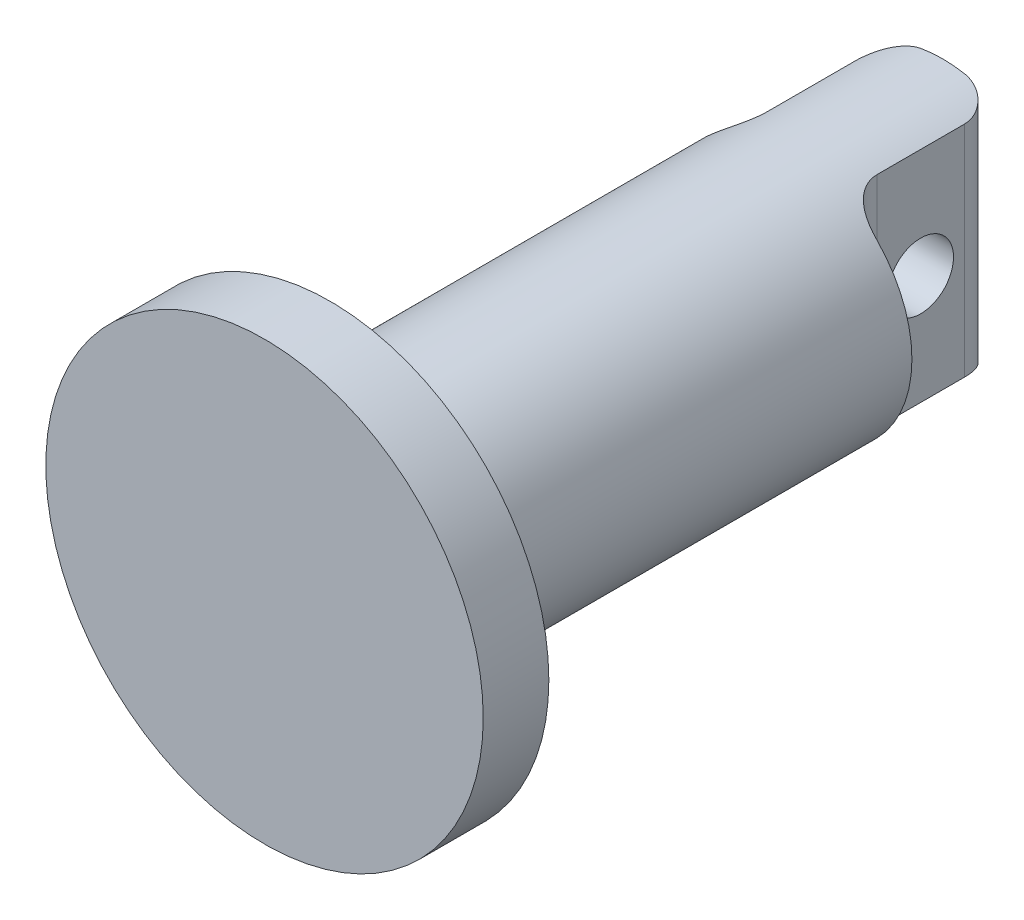
from build123d import *
from OCP.BRepFilletAPI import BRepFilletAPI_MakeFillet

# Parameters (mm, degrees)
SKETCH1_R           = 10
BOSS_EXTRUDE1_DEPTH = 3
SKETCH2_R           = 5.6
BOSS_EXTRUDE2_DEPTH = 28
CUT_EXTRUDE1_DEPTH  = 7
CUT_EXTRUDE2_REACH  = 34.253
SKETCH4_R           = 1.5
FILLET1_R1          = 3
FILLET1_R2          = 1.5


with BuildPart() as part:
    # Sketch1 → Boss-Extrude1 (new body)
    with BuildSketch(Plane.XY):
        Circle(SKETCH1_R)
    extrude(amount=BOSS_EXTRUDE1_DEPTH)

    # Sketch2 → Boss-Extrude2 (add)
    with BuildSketch(Plane(origin=(0, 0, 0), x_dir=(-1, 0, 0), z_dir=(0, 0, -1))):
        with Locations(Location((0, 0, 0), (0, 0, 180))):
            Circle(SKETCH2_R)
    extrude(amount=BOSS_EXTRUDE2_DEPTH)

    # Sketch3 → Cut-Extrude1 (cut)
    with BuildSketch(Plane(origin=(0, 0, -28), x_dir=(-1, 0, 0), z_dir=(0, 0, -1))):
        with BuildLine():
            Line((2.5, 0), (2.5, 6.663171691))
            ThreePointArc((2.5, 6.663171691), (8.066213365, -0.537352556), (2.5, -7.737876802))
            Line((2.5, -7.737876802), (2.5, 0))
        make_face()
        with BuildLine():
            Line((-2.5, 0), (-2.5, 6.663171691))
            ThreePointArc((-2.5, 6.663171691), (-7.668145551, -0.537352556), (-2.5, -7.737876802))
            Line((-2.5, -7.737876802), (-2.5, 0))
        make_face()
    extrude(amount=-CUT_EXTRUDE1_DEPTH, mode=Mode.SUBTRACT)

    # Sketch4 → Cut-Extrude2 (cut, up to next)
    with BuildSketch(Plane(origin=(2.5, 0, 0), x_dir=(0, 0, -1), z_dir=(1, 0, 0)), mode=Mode.PRIVATE) as cut_extrude2_sk1:
        with Locations((24.5, 0)):
            Circle(SKETCH4_R)
    cut_extrude2_tool1 = extrude(cut_extrude2_sk1.sketch, amount=-CUT_EXTRUDE2_REACH, mode=Mode.PRIVATE) & part.part
    add(cut_extrude2_tool1.solids().sort_by_distance((2.5, 0, -24.5))[0], mode=Mode.SUBTRACT)

    # Fillet1: one fillet with a radius per group of edges: ONE call of the kernel's fillet builder (fillet() takes one radius for all edges)
    fillet1_edges_1 = [part.edges().sort_by_distance(p)[0] for p in [
        (-5.6, 0, 0),
    ]]
    fillet1_edges_2 = [part.edges().sort_by_distance(p)[0] for p in [
        (2.5, 0, -21),
        (-2.5, 0, -21),
        (2.5, 0, -28),
        (-2.5, 0, -28),
    ]]
    fillet1 = BRepFilletAPI_MakeFillet(part.part.solid().wrapped)
    for e in fillet1_edges_1:
        fillet1.Add(FILLET1_R1, e.wrapped)
    for e in fillet1_edges_2:
        fillet1.Add(FILLET1_R2, e.wrapped)
    add(Compound.cast(fillet1.Shape()), mode=Mode.REPLACE)


solid = part.part
